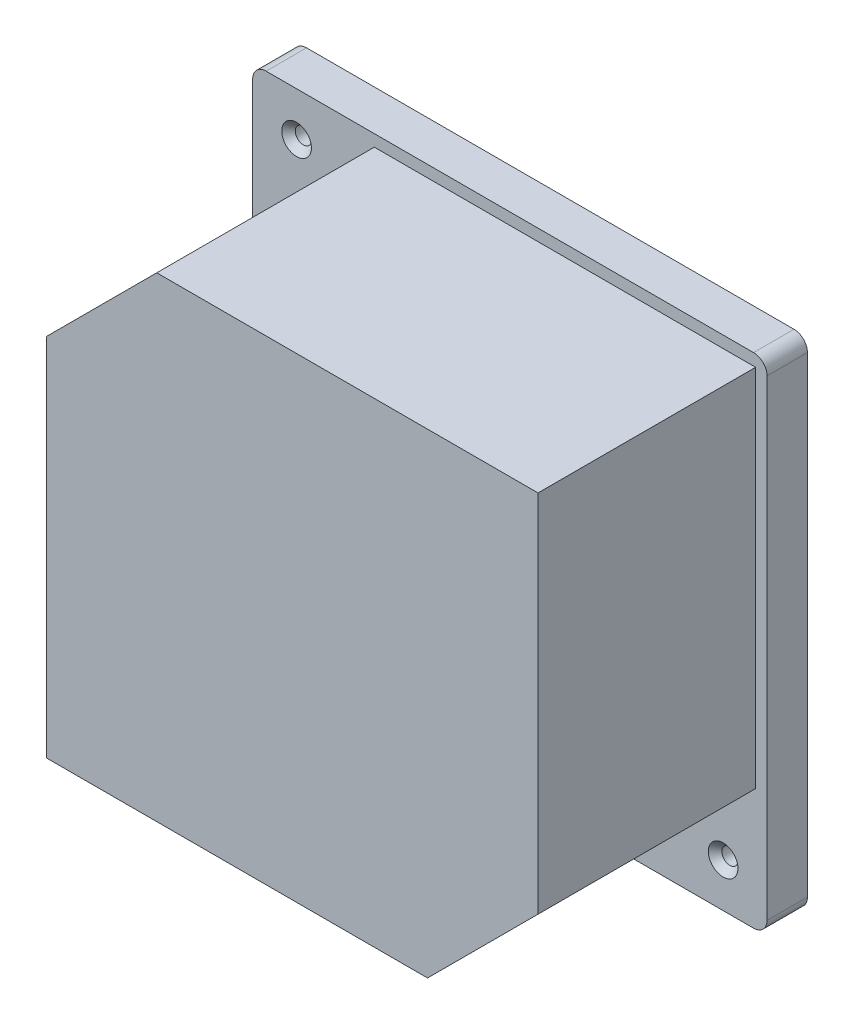
from build123d import *

# Parameters (mm, degrees)
SKETCH1_W                                            = 76.36
SKETCH1_H                                            = 74
BOSS_EXTRUDE1_DEPTH                                  = 6
FILLET1_R                                            = 2
FILLET2_R                                            = 2
FILLET3_R                                            = 2
FILLET4_R                                            = 2
CSK_FOR_M2_COUNTERSUNK_RAISED_HEAD_SCREW_D           = 2.4
CSK_FOR_M2_COUNTERSUNK_RAISED_HEAD_SCREW_CSINK_D     = 4.4
CSK_FOR_M2_COUNTERSUNK_RAISED_HEAD_SCREW_CSINK_ANGLE = 90
BOSS_EXTRUDE2_DEPTH                                  = 38.3
CUT_EXTRUDE1_DEPTH                                   = 36.3
SKETCH8_W                                            = 37.9
SKETCH8_H                                            = 21.6
CUT_EXTRUDE2_DEPTH                                   = 10


with BuildPart() as part:
    # Sketch1 → Boss-Extrude1 (new body)
    with BuildSketch(Plane.XY):
        with Locations((5.593243707, -7.586756293)):
            Rectangle(SKETCH1_W, SKETCH1_H)
    extrude(amount=BOSS_EXTRUDE1_DEPTH)

    # Fillet1
    fillet1_edges = [part.edges().sort_by_distance(p)[0] for p in [
        (-32.586756293, 29.413243707, 3),
    ]]
    fillet(fillet1_edges, radius=FILLET1_R)

    # Fillet2
    fillet2_edges = [part.edges().sort_by_distance(p)[0] for p in [
        (43.773243707, 29.413243707, 3),
    ]]
    fillet(fillet2_edges, radius=FILLET2_R)

    # Fillet3
    fillet3_edges = [part.edges().sort_by_distance(p)[0] for p in [
        (-32.586756293, -44.586756293, 3),
    ]]
    fillet(fillet3_edges, radius=FILLET3_R)

    # Fillet4
    fillet4_edges = [part.edges().sort_by_distance(p)[0] for p in [
        (43.773243707, -44.586756293, 3),
    ]]
    fillet(fillet4_edges, radius=FILLET4_R)

    # CSK for M2 Countersunk Raised Head Screw1 (through all)
    with Locations(Plane.XY.offset(6)):
        with Locations((-26.066697121, 22.893243707), (37.255416012, -38.066697121)):
            CounterSinkHole(CSK_FOR_M2_COUNTERSUNK_RAISED_HEAD_SCREW_D / 2, CSK_FOR_M2_COUNTERSUNK_RAISED_HEAD_SCREW_CSINK_D / 2, counter_sink_angle=CSK_FOR_M2_COUNTERSUNK_RAISED_HEAD_SCREW_CSINK_ANGLE)

    # Sketch2 → Boss-Extrude2 (add)
    with BuildSketch(Plane.XY):
        Polygon((42.073243707, -26.488928598), (42.073243707, 27.673243707), (-14.526756293, 27.673243707), (-30.886756293, 11.313243707), (-30.886756293, -42.886756293), (25.675416012, -42.886756293), align=None)
    extrude(amount=BOSS_EXTRUDE2_DEPTH)

    # Sketch3 → Cut-Extrude1 (cut)
    with BuildSketch(Plane(origin=(0, 0, 0), x_dir=(-1, 0, 0), z_dir=(0, 0, -1))):
        Polygon((-25.168605052, -40.786756293), (28.786756293, -40.786756293), (28.786756293, 10.491732857), (13.386650304, 25.613243707), (-39.791667004, 25.613243707), (-39.975416012, -26.119028061), align=None)
    extrude(amount=-CUT_EXTRUDE1_DEPTH, mode=Mode.SUBTRACT)

    # Sketch8 → Cut-Extrude2 (cut)
    with BuildSketch(Plane.XZ.offset(42.886756293)):
        with Locations((-6, 22)):
            Rectangle(SKETCH8_W, SKETCH8_H)
    extrude(amount=-CUT_EXTRUDE2_DEPTH, mode=Mode.SUBTRACT)


solid = part.part
